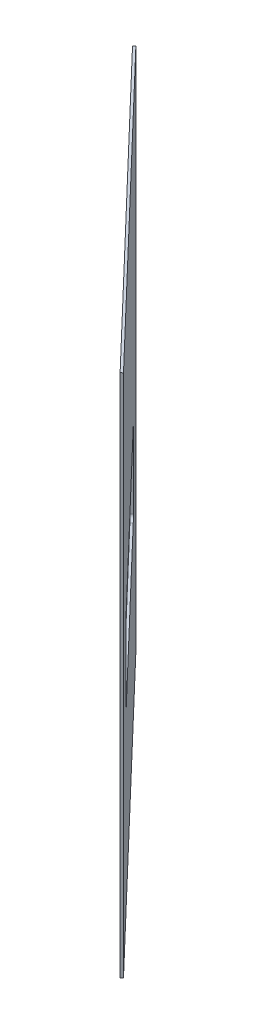
from build123d import *

# Parameters (mm, degrees)
SKETCH1_W           = 1066.8
SKETCH1_H           = 1397
BOSS_EXTRUDE1_DEPTH = 6.35


with BuildPart() as part:
    # Sketch1 → Boss-Extrude1 (new body)
    with BuildSketch(Plane(origin=(6993.279954705, 0, -6693.457613122), x_dir=(0.6914509803921883, 0, 0.722423381207088), z_dir=(-0.722423381207088, 0, 0.6914509803921883))):
        with Locations((-1547.448135129, 704.85)):
            Rectangle(SKETCH1_W, SKETCH1_H)
        with BuildLine():
            Line((-1242.648135129, 685.8), (-1852.248135129, 685.8))
            ThreePointArc((-1852.248135129, 685.8), (-1861.22839125, 682.080256121), (-1864.948135129, 673.1))
            Line((-1864.948135129, 673.1), (-1864.948135129, 476.25))
            ThreePointArc((-1864.948135129, 476.25), (-1861.22839125, 467.269743879), (-1852.248135129, 463.55))
            Line((-1852.248135129, 463.55), (-1242.648135129, 463.55))
            ThreePointArc((-1242.648135129, 463.55), (-1233.667879008, 467.269743879), (-1229.948135129, 476.25))
            Line((-1229.948135129, 476.25), (-1229.948135129, 673.1))
            ThreePointArc((-1229.948135129, 673.1), (-1233.667879008, 682.080256121), (-1242.648135129, 685.8))
        make_face(mode=Mode.SUBTRACT)
    extrude(amount=-BOSS_EXTRUDE1_DEPTH)


solid = part.part
